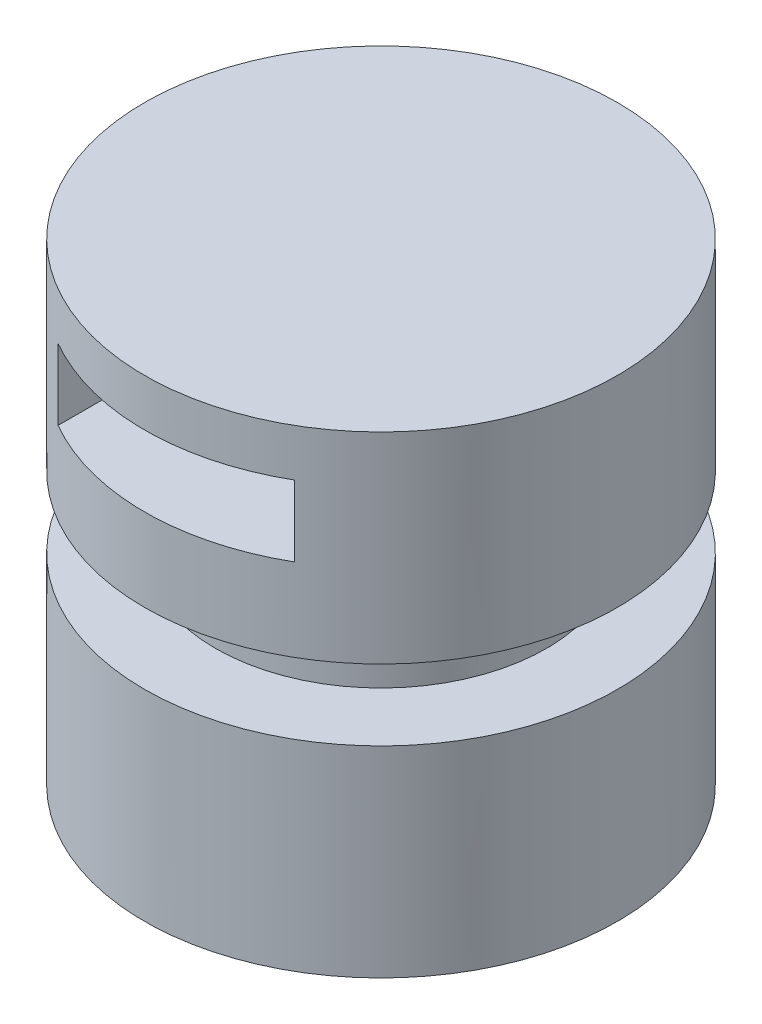
from build123d import *

# Parameters (mm, degrees)
SKETCH1_W               = 100
SKETCH1_H               = 200
SKETCH3_W               = 30
SKETCH3_H               = 30
CUT_EXTRUDE1_DEPTH      = 245.948974278
CUT_EXTRUDE1_DEPTH_BACK = 245.948974278
SKETCH4_W               = 100
SKETCH4_H               = 30


with BuildPart() as part:
    # Sketch1 → Revolve1 (revolve)
    with BuildSketch(Plane.XY, mode=Mode.PRIVATE) as revolve1_sk:
        with Locations((50, 100)):
            Rectangle(SKETCH1_W, SKETCH1_H)
    revolve(revolve1_sk.sketch.rotate(Axis((0, 0, 0), (0, 1, 0)), 90), axis=Axis((0, 0, 0), (0, 1, 0)))

    # Sketch3 → Cut-Revolve1 (revolve, cut)
    with BuildSketch(Plane(origin=(0, 0, 0), x_dir=(0, 0, -1), z_dir=(1, 0, 0))):
        with Locations((85, 100)):
            Rectangle(SKETCH3_W, SKETCH3_H)
    revolve(axis=Axis((0, 200, 0), (0, -1, 0)), mode=Mode.SUBTRACT)

    # Sketch4 → Cut-Extrude1 (cut, two sides: drawn at the far end of the back side and taken through both)
    with BuildSketch(Plane.XY.offset(-CUT_EXTRUDE1_DEPTH_BACK)):
        with Locations((0, 165)):
            Rectangle(SKETCH4_W, SKETCH4_H)
    extrude(amount=CUT_EXTRUDE1_DEPTH + CUT_EXTRUDE1_DEPTH_BACK, mode=Mode.SUBTRACT)


solid = part.part
